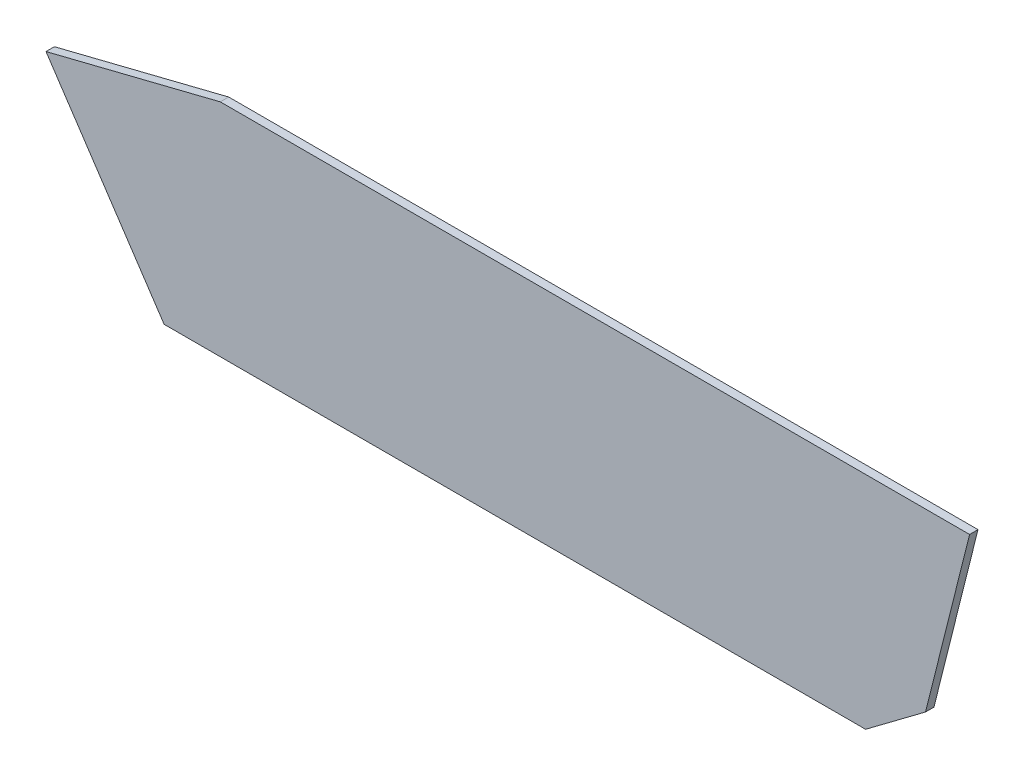
from build123d import *

# Parameters (mm, degrees)
BOSS_EXTRUDE1_DEPTH = 4.7625


with BuildPart() as part:
    # Sketch1 → Boss-Extrude1 (new body)
    with BuildSketch(Plane.XY):
        Polygon((425, 28.570833333), (0, 28.570833333), (-98.879411765, 3.850980392), (-31.879411765, -96.649019608), (366, -96.649019608), (400, -71.149019608), align=None)
    extrude(amount=BOSS_EXTRUDE1_DEPTH)


solid = part.part
